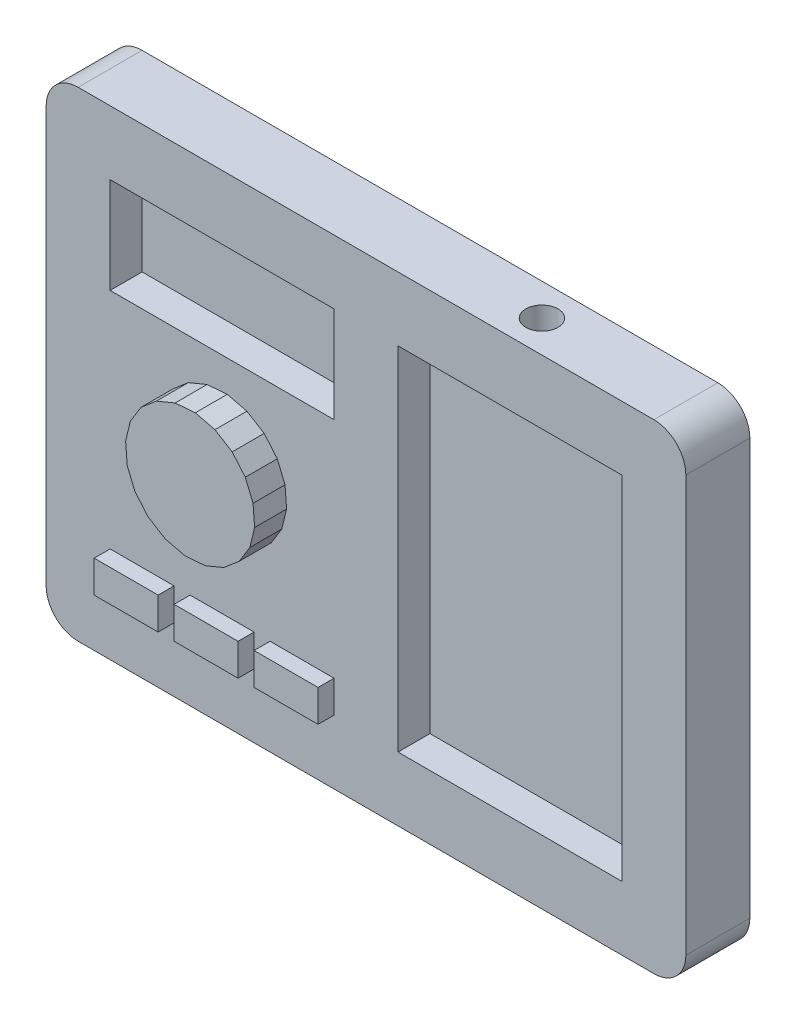
from build123d import *

# Parameters (mm, degrees)
BOSS_EXTRUDE1_DEPTH = 20
SKETCH2_W           = 70
SKETCH2_H           = 110
SKETCH2_H_2         = 30
CUT_EXTRUDE1_DEPTH  = 10
SKETCH3_R           = 5.022739635
CUT_EXTRUDE2_DEPTH  = 10
SKETCH4_W           = 12
SKETCH4_H           = 4.5
CUT_EXTRUDE3_DEPTH  = 20
BOSS_EXTRUDE3_DEPTH = 10
SKETCH6_W           = 20
SKETCH6_H           = 10
BOSS_EXTRUDE4_DEPTH = 5


with BuildPart() as part:
    # Sketch1 → Boss-Extrude1 (new body)
    with BuildSketch(Plane.XY):
        with BuildLine():
            Line((10, 0), (190, 0))
            ThreePointArc((190, 0), (197.071067812, 2.928932188), (200, 10))
            Line((200, 10), (200, 140))
            ThreePointArc((200, 140), (197.071067812, 147.071067812), (190, 150))
            Line((190, 150), (10, 150))
            ThreePointArc((10, 150), (2.928932188, 147.071067812), (0, 140))
            Line((0, 140), (0, 10))
            ThreePointArc((0, 10), (2.928932188, 2.928932188), (10, 0))
        make_face()
    extrude(amount=BOSS_EXTRUDE1_DEPTH)

    # Sketch2 → Cut-Extrude1 (cut)
    with BuildSketch(Plane.XY.offset(20)):
        with Locations((145, 75)):
            Rectangle(SKETCH2_W, SKETCH2_H)
        with Locations((55, 115)):
            Rectangle(SKETCH2_W, SKETCH2_H_2)
    extrude(amount=-CUT_EXTRUDE1_DEPTH, mode=Mode.SUBTRACT)

    # Sketch3 → Cut-Extrude2 (cut)
    with BuildSketch(Plane(origin=(0, 150, 0), x_dir=(1, 0, 0), z_dir=(0, 1, 0))):
        with Locations(Location((145, -10, 0), (0, 0, 270))):
            Circle(SKETCH3_R)
    extrude(amount=-CUT_EXTRUDE2_DEPTH, mode=Mode.SUBTRACT)

    # Sketch4 → Cut-Extrude3 (cut)
    with BuildSketch(Plane.XZ):
        with Locations((56, 7.75)):
            Rectangle(SKETCH4_W, SKETCH4_H)
    extrude(amount=-CUT_EXTRUDE3_DEPTH, mode=Mode.SUBTRACT)

    # Sketch5 → Boss-Extrude3 (add)
    with BuildSketch(Plane.XY.offset(20)):
        Polygon((68.158579738, 85.363225843), (62.767055131, 88.67752081), (56.615237052, 90.163529906), (50.305308316, 89.675792208), (44.454928712, 87.262050879), (39.636774157, 83.158579738), (36.32247919, 77.767055131), (34.836470094, 71.615237052), (35.324207792, 65.305308316), (37.737949121, 59.454928712), (41.841420262, 54.636774157), (47.232944869, 51.32247919), (53.384762948, 49.836470094), (59.694691684, 50.324207792), (65.545071288, 52.737949121), (70.363225843, 56.841420262), (73.67752081, 62.232944869), (75.163529906, 68.384762948), (74.675792208, 74.694691684), (72.262050879, 80.545071288), align=None)
    extrude(amount=BOSS_EXTRUDE3_DEPTH)

    # Sketch6 → Boss-Extrude4 (add)
    with BuildSketch(Plane.XY.offset(20)):
        with Locations((30, 25)):
            Rectangle(SKETCH6_W, SKETCH6_H)
        with Locations((55, 25)):
            Rectangle(SKETCH6_W, SKETCH6_H)
        with Locations((80, 25)):
            Rectangle(SKETCH6_W, SKETCH6_H)
    extrude(amount=BOSS_EXTRUDE4_DEPTH)


solid = part.part
